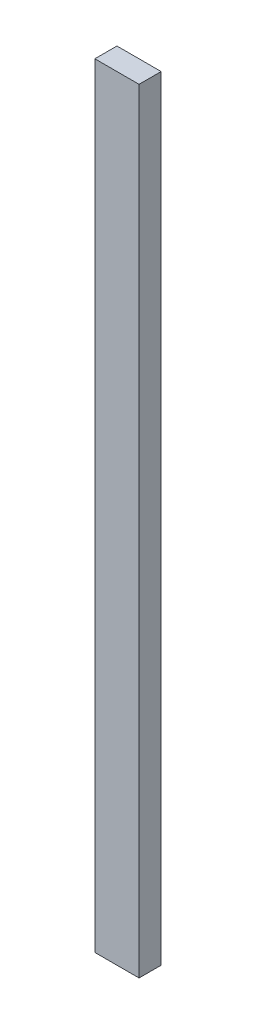
from build123d import *

# Parameters (mm, degrees)
SKETCH1_W           = 50.8
SKETCH1_H           = 25.4
BOSS_EXTRUDE2_DEPTH = 889


with BuildPart() as part:
    # Sketch1 → Boss-Extrude2 (new body)
    with BuildSketch(Plane(origin=(0, 0, 0), x_dir=(1, 0, 0), z_dir=(0, 1, 0))):
        Rectangle(SKETCH1_W, SKETCH1_H)
    extrude(amount=BOSS_EXTRUDE2_DEPTH)


solid = part.part
